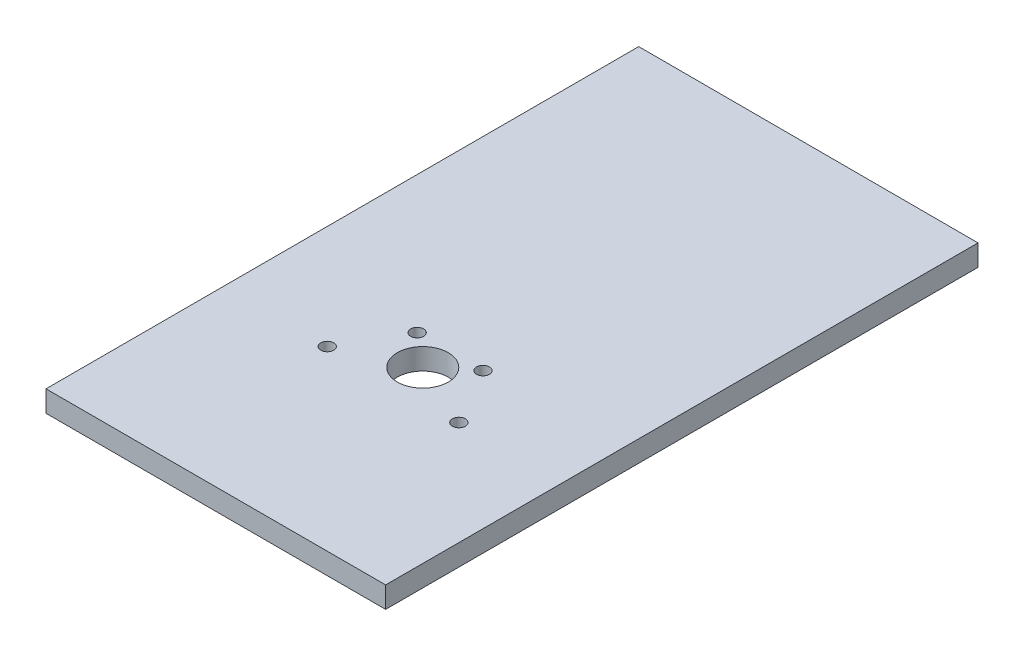
from build123d import *

# Parameters (mm, degrees)
SKETCH1_R           = 6
SKETCH1_R_2         = 1.525
BOSS_EXTRUDE1_DEPTH = 5


with BuildPart() as part:
    # Sketch1 → Boss-Extrude1 (new body)
    with BuildSketch(Plane(origin=(0, 0, 0), x_dir=(1, 0, 0), z_dir=(0, 1, 0))):
        Polygon((0, -40.379460215), (80, -40.467284232), (80, -180), (0, -180), align=None)
        with Locations(Location((40, -131.25, 0), (0, 0, 270))):
            Circle(SKETCH1_R, mode=Mode.SUBTRACT)
        with Locations(Location((24.5, -138.25, 0), (0, 0, 270))):
            Circle(SKETCH1_R_2, mode=Mode.SUBTRACT)
        with Locations(Location((55.5, -138.25, 0), (0, 0, 270))):
            Circle(SKETCH1_R_2, mode=Mode.SUBTRACT)
        with Locations(Location((32.25, -124.826606241, 0), (0, 0, 270))):
            Circle(SKETCH1_R_2, mode=Mode.SUBTRACT)
        with Locations(Location((47.75, -124.826606241, 0), (0, 0, 270))):
            Circle(SKETCH1_R_2, mode=Mode.SUBTRACT)
    extrude(amount=BOSS_EXTRUDE1_DEPTH)


solid = part.part
